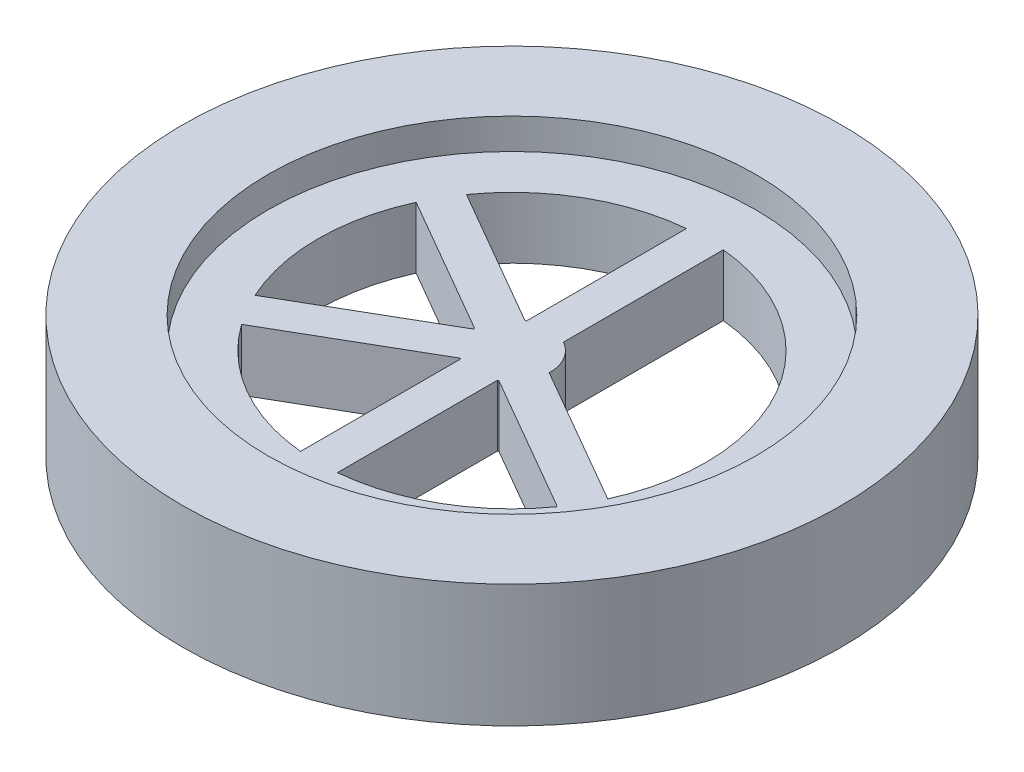
from build123d import *

# Parameters (mm, degrees)
SKETCH1_R           = 53.695322997
BOSS_EXTRUDE2_DEPTH = 10
SKETCH3_R           = 39.733093336
CUT_EXTRUDE2_DEPTH  = 10
SKETCH4_R           = 39.733093336
SKETCH4_R_2         = 31.58457531
BOSS_EXTRUDE3_DEPTH = 5
BOSS_EXTRUDE4_DEPTH = 5
CIRPATTERN3_COUNT   = 5
CIRPATTERN3_ANGLE   = 240


with BuildPart() as part:
    # Sketch1 → Boss-Extrude2 (new, symmetric)
    with BuildSketch(Plane(origin=(0, 0, 0), x_dir=(1, 0, 0), z_dir=(0, 1, 0))):
        with Locations(Location((0, 0, 0), (0, 0, 270))):
            Circle(SKETCH1_R)
    extrude(amount=BOSS_EXTRUDE2_DEPTH, both=True)

    # Sketch3 → Cut-Extrude2 (cut, symmetric)
    with BuildSketch(Plane(origin=(0, 0, 0), x_dir=(1, 0, 0), z_dir=(0, 1, 0))):
        with Locations(Location((0, 0, 0), (0, 0, 270))):
            Circle(SKETCH3_R)
    extrude(amount=CUT_EXTRUDE2_DEPTH, both=True, mode=Mode.SUBTRACT)

    # Sketch4 → Boss-Extrude3 (add, symmetric)
    with BuildSketch(Plane(origin=(0, 0, 0), x_dir=(1, 0, 0), z_dir=(0, 1, 0))):
        with Locations(Location((0, 0, 0), (0, 0, 270))):
            Circle(SKETCH4_R)
        with Locations(Location((0, 0, 0), (0, 0, 270))):
            Circle(SKETCH4_R_2, mode=Mode.SUBTRACT)
    extrude(amount=BOSS_EXTRUDE3_DEPTH, both=True)

    # Sketch6 → Boss-Extrude4 (add, symmetric)
    with BuildSketch(Plane(origin=(0, 0, 0), x_dir=(1, 0, 0), z_dir=(0, 1, 0))):
        with BuildLine():
            Line((3, 5.387115822), (3, 39.619675744))
            Line((3, 39.619675744), (-3, 39.619675744))
            Line((-3, 39.619675744), (-3, 5.387115822))
            ThreePointArc((-3, 5.387115822), (0, -6.166118461), (3, 5.387115822))
        make_face()
    boss_extrude4 = extrude(amount=BOSS_EXTRUDE4_DEPTH, both=True)

    # CirPattern3: Boss-Extrude4 ×5 about axis
    cirpattern3_axis = Axis((0, 0, 0), (0, 1, 0))
    for i in range(1, CIRPATTERN3_COUNT):
        add(boss_extrude4.rotate(cirpattern3_axis, i * CIRPATTERN3_ANGLE / (CIRPATTERN3_COUNT - 1)))


solid = part.part
